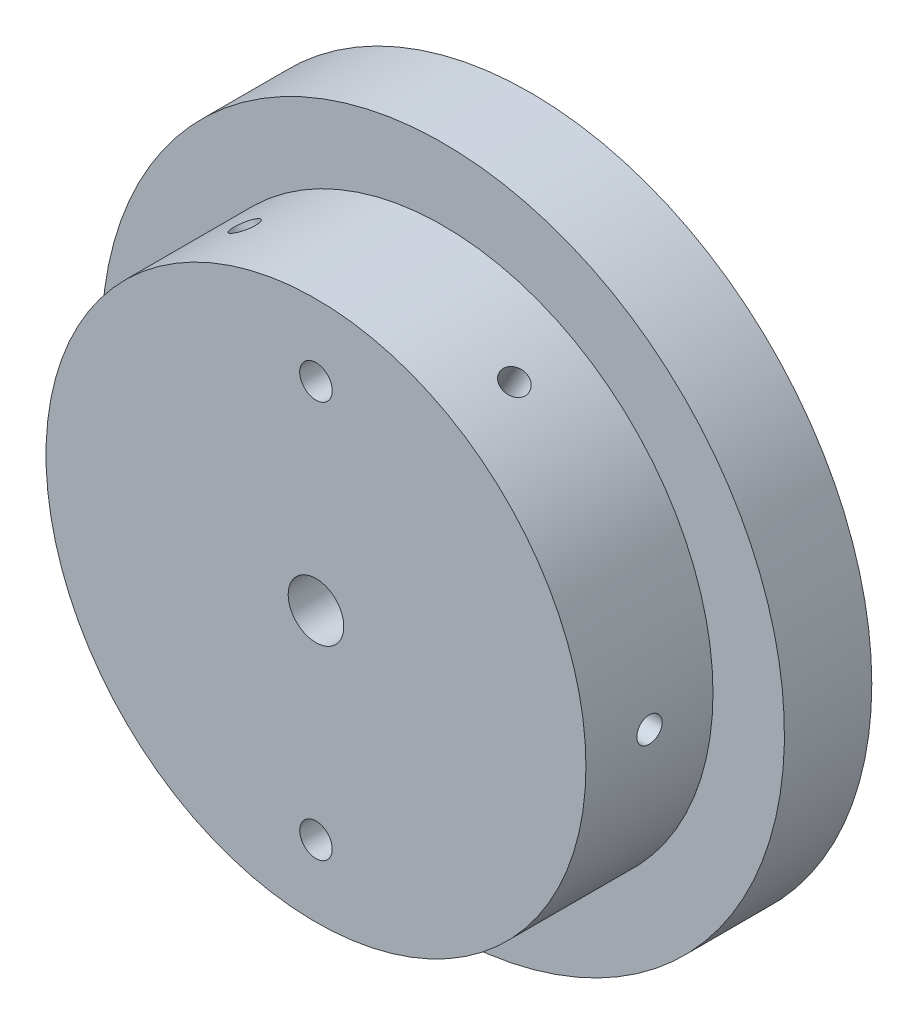
from build123d import *

# Parameters (mm, degrees)
SKETCH_1_R               = 17
EXTRUDE_1_DEPTH          = 8
SKETCH_2_R               = 21.5
EXTRUDE_2_DEPTH          = 5.5
SKETCH_3_R               = 1.75
CUT_EXTRUDE_1_DEPTH      = 34.26785235
CUT_EXTRUDE_START        = -3.5
CUT_EXTRUDE_2_DEPTH      = 3.5
SKETCH_5_R               = 1.025
CUT_EXTRUDE_3_DEPTH      = 34.26785235
SKETCH_5_3_R             = 0.8
CUT_EXTRUDE_4_DEPTH      = 8
SKETCH_6_R               = 0.8
CUT_EXTRUDE_5_DEPTH      = 3
PATTERN_CIRCULAR_1_COUNT = 6
SKETCH_7_R               = 2
CUT_EXTRUDE_6_DEPTH      = 5
SKETCH_8_R               = 0.8
CUT_EXTRUDE_7_DEPTH      = 5


with BuildPart() as part:
    # 草图1 → 凸台-拉伸1 (new body)
    with BuildSketch(Plane.XY):
        Circle(SKETCH_1_R)
    extrude(amount=EXTRUDE_1_DEPTH)

    # 草图2 → 凸台-拉伸2 (add)
    with BuildSketch(Plane(origin=(0, 0, 0), x_dir=(-1, 0, 0), z_dir=(0, 0, -1))):
        Circle(SKETCH_2_R)
    extrude(amount=EXTRUDE_2_DEPTH)

    # 草图3 → 切除-拉伸1 (cut, through all)
    with BuildSketch(Plane(origin=(0, 0, -5.5), x_dir=(-1, 0, 0), z_dir=(0, 0, -1))):
        Circle(SKETCH_3_R)
    extrude(amount=-CUT_EXTRUDE_1_DEPTH, mode=Mode.SUBTRACT)

    # 草图4 → 切除-拉伸2 (cut)
    with BuildSketch(Plane(origin=(0, 0, -5.5), x_dir=(-1, 0, 0), z_dir=(0, 0, -1)).offset(CUT_EXTRUDE_START)):
        with BuildLine():
            Line((0, 7.5), (20.14944168, 7.5))
            ThreePointArc((20.14944168, 7.5), (21.5, 0), (20.14944168, -7.5))
            Line((20.14944168, -7.5), (0, -7.5))
            ThreePointArc((0, -7.5), (-7.5, 0), (0, 7.5))
        make_face()
    extrude(amount=CUT_EXTRUDE_2_DEPTH, mode=Mode.SUBTRACT)

    # 草图5 → 切除-拉伸3 (cut, through all)
    with BuildSketch(Plane(origin=(0, 0, -5.5), x_dir=(-1, 0, 0), z_dir=(0, 0, -1))):
        with Locations((0, -12.5)):
            Circle(SKETCH_5_R)
        with Locations((0, 12.5)):
            Circle(SKETCH_5_R)
    extrude(amount=-CUT_EXTRUDE_3_DEPTH, mode=Mode.SUBTRACT)

    # 草图5<3> → 切除-拉伸4 (cut)
    with BuildSketch(Plane(origin=(0, 0, -5.5), x_dir=(-1, 0, 0), z_dir=(0, 0, -1))):
        with Locations((10, -12.5)):
            Circle(SKETCH_5_3_R)
        with Locations((10, 12.5)):
            Circle(SKETCH_5_3_R)
    extrude(amount=-CUT_EXTRUDE_4_DEPTH, mode=Mode.SUBTRACT)

    # 草图6 → 切除-拉伸5 (cut)
    with BuildSketch(Plane(origin=(17, 0, 0), x_dir=(0, 0, -1), z_dir=(1, 0, 0))):
        with Locations((-4, 0)):
            Circle(SKETCH_6_R)
    cut_extrude_5 = extrude(amount=-CUT_EXTRUDE_5_DEPTH, mode=Mode.SUBTRACT)

    # 阵列(圆周)1: 切除-拉伸5 ×6 about axis
    pattern_circular_1_axis = Axis((0, 0, 8), (0, 0, -1))
    for i in range(1, PATTERN_CIRCULAR_1_COUNT):
        add(cut_extrude_5.rotate(pattern_circular_1_axis, i * 360 / PATTERN_CIRCULAR_1_COUNT), mode=Mode.SUBTRACT)

    # 草图7 → 切除-拉伸6 (cut)
    with BuildSketch(Plane(origin=(0, 0, -2), x_dir=(-1, 0, 0), z_dir=(0, 0, -1))):
        with Locations((10.5, 0)):
            Circle(SKETCH_7_R)
    extrude(amount=-CUT_EXTRUDE_6_DEPTH, mode=Mode.SUBTRACT)

    # 草图8 → 切除-拉伸7 (cut)
    with BuildSketch(Plane(origin=(0, 0, -5.5), x_dir=(-1, 0, 0), z_dir=(0, 0, -1))):
        with Locations((-10, 0)):
            Circle(SKETCH_8_R)
    extrude(amount=-CUT_EXTRUDE_7_DEPTH, mode=Mode.SUBTRACT)


solid = part.part
